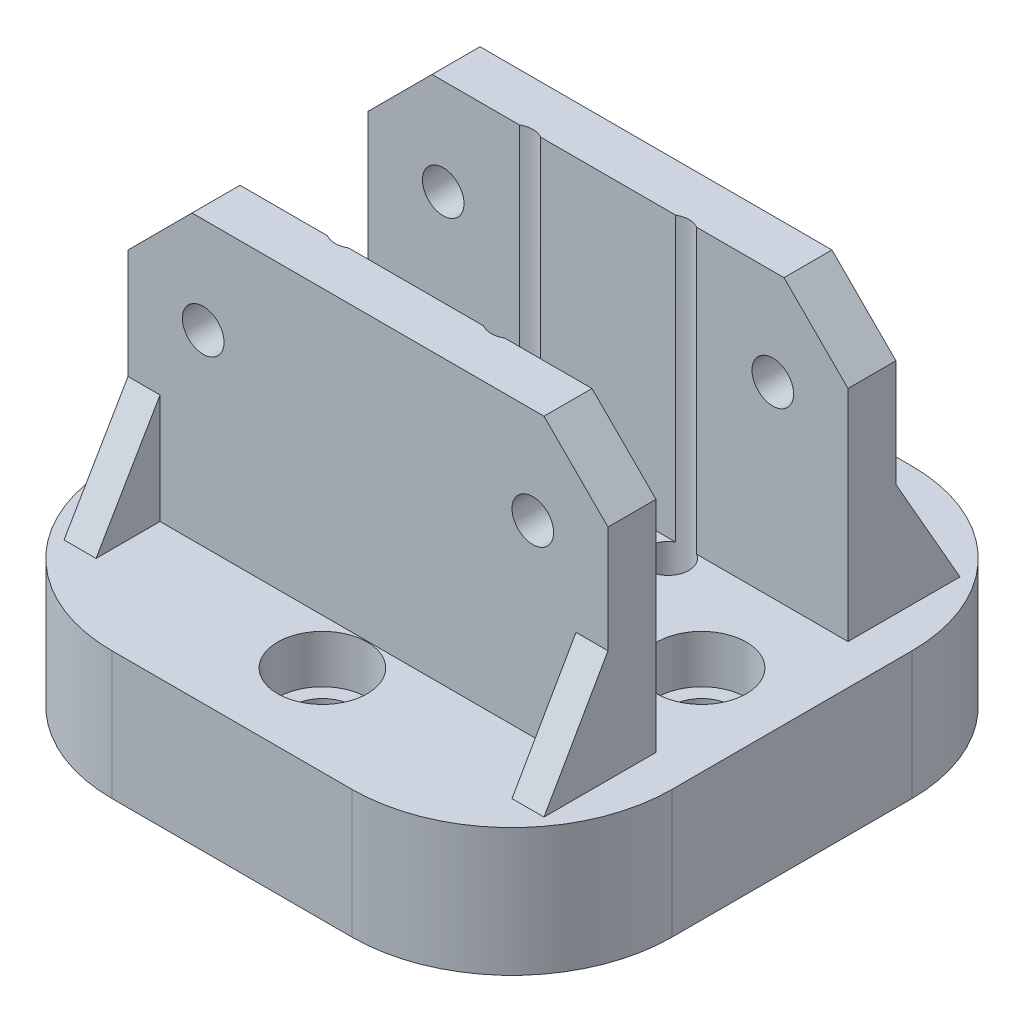
from build123d import *

# Parameters (mm, degrees)
SKETCH_2_R          = 1.3
EXTRUDE_1_DEPTH     = 9
SKETCH_3_W          = 30
SKETCH_3_H          = 20.835575778
CUT_EXTRUDE_1_DEPTH = 6
EXTRUDE_START       = -6.7
EXTRUDE_2_DEPTH     = 8
CUT_EXTRUDE_START   = -14.7
SKETCH_5_R          = 1.3
SKETCH_5_R_2        = 1.9
CUT_EXTRUDE_2_DEPTH = 30
EXTRUDE_3_DEPTH     = 2
EXTRUDE_4_DEPTH     = 2
SKETCH_11_R         = 2.8
CUT_EXTRUDE_3_DEPTH = 3


with BuildPart() as part:
    # 草图2 → 凸台-拉伸1 (new, symmetric)
    with BuildSketch(Plane.XY):
        Polygon((-11, 11), (11, 11), (15, 7), (15, -11), (-15, -11), (-15, 7), align=None)
        with Locations((-10.3, 5)):
            Circle(SKETCH_2_R, mode=Mode.SUBTRACT)
        with Locations(Location((10.3, 5, 0), (0, 0, 180))):
            Circle(SKETCH_2_R, mode=Mode.SUBTRACT)
    extrude(amount=EXTRUDE_1_DEPTH, both=True)

    # 草图3 → 切除-拉伸1 (cut, symmetric)
    with BuildSketch(Plane.XY):
        with Locations((0, 3.717787889)):
            Rectangle(SKETCH_3_W, SKETCH_3_H)
    extrude(amount=CUT_EXTRUDE_1_DEPTH, both=True, mode=Mode.SUBTRACT)

    # 草图6 → 凸台-拉伸2 (add)
    with BuildSketch(Plane(origin=(0, 0, 0), x_dir=(1, 0, 0), z_dir=(0, 1, 0)).offset(EXTRUDE_START)):
        with BuildLine():
            Line((-7.5, -17.5), (7.5, -17.5))
            ThreePointArc((7.5, -17.5), (14.571067812, -14.571067812), (17.5, -7.5))
            Line((17.5, -7.5), (17.5, 7.5))
            ThreePointArc((17.5, 7.5), (14.571067812, 14.571067812), (7.5, 17.5))
            Line((7.5, 17.5), (-7.5, 17.5))
            ThreePointArc((-7.5, 17.5), (-14.571067812, 14.571067812), (-17.5, 7.5))
            Line((-17.5, 7.5), (-17.5, -7.5))
            ThreePointArc((-17.5, -7.5), (-14.571067812, -14.571067812), (-7.5, -17.5))
        make_face()
    extrude(amount=-EXTRUDE_2_DEPTH)

    # 草图5 → 切除-拉伸2 (cut)
    with BuildSketch(Plane(origin=(0, 0, 0), x_dir=(1, 0, 0), z_dir=(0, 1, 0)).offset(CUT_EXTRUDE_START)):
        with Locations(Location((0, 0, 0), (0, 0, 90))):
            Circle(SKETCH_5_R)
        with Locations(Location((-4.87903679, 4.87903679, 0), (0, 0, 90))):
            Circle(SKETCH_5_R)
        with Locations(Location((-11.85, 0, 0), (0, 0, 90))):
            Circle(SKETCH_5_R_2)
        with Locations(Location((0, 11.85, 0), (0, 0, 90))):
            Circle(SKETCH_5_R_2)
        with Locations(Location((4.87903679, 4.87903679, 0), (0, 0, 90))):
            Circle(SKETCH_5_R)
        with Locations(Location((11.85, 0, 0), (0, 0, 90))):
            Circle(SKETCH_5_R_2)
        with Locations(Location((4.87903679, -4.87903679, 0), (0, 0, 90))):
            Circle(SKETCH_5_R)
        with Locations(Location((0, -11.85, 0), (0, 0, 90))):
            Circle(SKETCH_5_R_2)
        with Locations(Location((-4.87903679, -4.87903679, 0), (0, 0, 90))):
            Circle(SKETCH_5_R)
    extrude(amount=CUT_EXTRUDE_2_DEPTH, mode=Mode.SUBTRACT)

    # 草图7 → 凸台-拉伸3 (add)
    with BuildSketch(Plane(origin=(15, 0, 0), x_dir=(0, 0, -1), z_dir=(1, 0, 0))):
        Polygon((-9, 0.3), (-13, -6.7), (-9, -6.7), align=None)
        Polygon((9, -6.7), (9, 0.3), (13, -6.7), align=None)
    extrude(amount=-EXTRUDE_3_DEPTH)

    # 草图10 → 凸台-拉伸4 (add)
    with BuildSketch(Plane.ZY.offset(15)):
        Polygon((-9, 0.15), (-13, -6.7), (-9, -6.7), align=None)
        Polygon((9, -6.7), (9, 0.15), (13, -6.7), align=None)
    extrude(amount=-EXTRUDE_4_DEPTH)

    # 草图11 → 切除-拉伸3 (cut)
    with BuildSketch(Plane(origin=(0, -6.7, 0), x_dir=(1, 0, 0), z_dir=(0, 1, 0))):
        with Locations(Location((0, 11.85, 0), (0, 0, 270))):
            Circle(SKETCH_11_R)
        with Locations(Location((11.85, 0, 0), (0, 0, 270))):
            Circle(SKETCH_11_R)
        with Locations(Location((0, -11.85, 0), (0, 0, 270))):
            Circle(SKETCH_11_R)
        with Locations(Location((-11.85, 0, 0), (0, 0, 270))):
            Circle(SKETCH_11_R)
    extrude(amount=-CUT_EXTRUDE_3_DEPTH, mode=Mode.SUBTRACT)


solid = part.part
